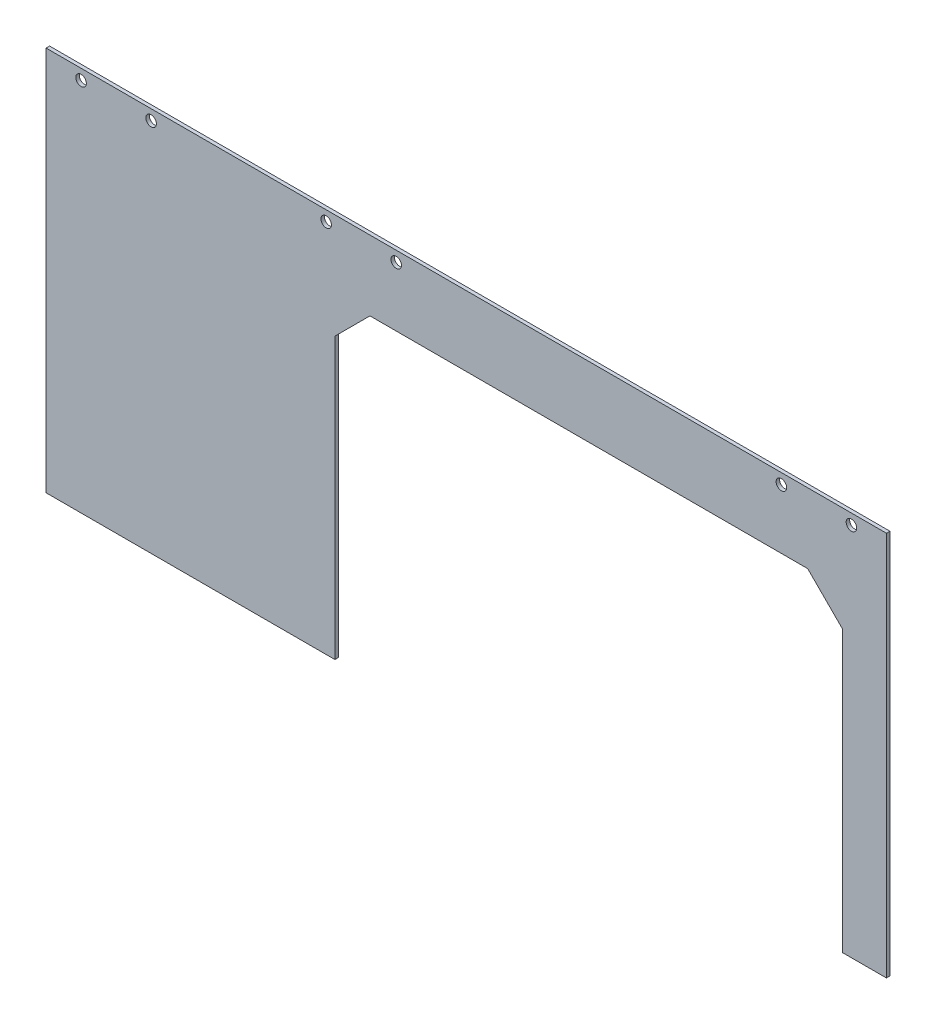
from build123d import *

# Parameters (mm, degrees)
SKETCH_1_R      = 1.5
EXTRUDE_1_DEPTH = 1
CHAMFER_1_SIZE  = 10


with BuildPart() as part:
    # 草图1 → 凸台-拉伸1 (new body)
    with BuildSketch(Plane.XY):
        Polygon((0, 0), (0, 110), (240, 110), (240, 0), (227.5, 0), (227.5, 90), (82.5, 90), (82.5, 0), align=None)
        with Locations((10, 107)):
            Circle(SKETCH_1_R, mode=Mode.SUBTRACT)
        with Locations((30, 107)):
            Circle(SKETCH_1_R, mode=Mode.SUBTRACT)
        with Locations((210, 107)):
            Circle(SKETCH_1_R, mode=Mode.SUBTRACT)
        with Locations((230, 107)):
            Circle(SKETCH_1_R, mode=Mode.SUBTRACT)
        with Locations(Location((80, 107, 0), (0, 0, 180))):
            Circle(SKETCH_1_R, mode=Mode.SUBTRACT)
        with Locations(Location((100, 107, 0), (0, 0, 180))):
            Circle(SKETCH_1_R, mode=Mode.SUBTRACT)
    extrude(amount=EXTRUDE_1_DEPTH)

    # 倒角1
    chamfer_1_edges = [part.edges().sort_by_distance(p)[0] for p in [
        (227.5, 90, 0.5),
        (82.5, 90, 0.5),
    ]]
    chamfer(chamfer_1_edges, length=CHAMFER_1_SIZE)


solid = part.part
